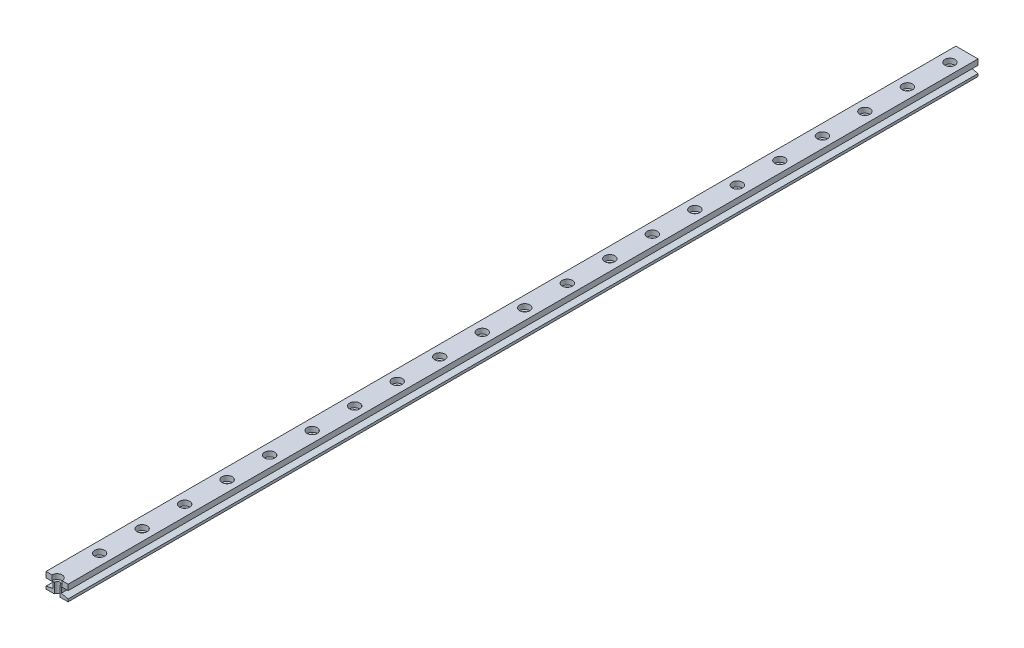
from build123d import *

# Parameters (mm, degrees)
EXTRUDE_1_DEPTH        = 800
SKETCH_2_R             = 3
CUT_EXTRUDE_1_DEPTH    = 3
CUT_EXTRUDE_2_REACH    = 802.049
SKETCH_3_R             = 1.6
PATTERN_LINEAR_1_COUNT = 32
PATTERN_LINEAR_1_PITCH = 25
SKETCH_5_W             = 302.225759888
SKETCH_5_H             = 503.019586662
CUT_EXTRUDE_3_DEPTH    = 10
SKETCH_6_W             = 27.58058317
SKETCH_6_H             = 207.193316332
CUT_EXTRUDE_4_DEPTH    = 10


with BuildPart() as part:
    # 草图1 → 凸台-拉伸1 (new body)
    with BuildSketch(Plane.XY):
        Polygon((-6.5, 4.5), (6.5, 4.5), (6.5, 1.2), (2.5, 1.2), (2.5, -2.076527235), (6.5, -3), (6.5, -4.5), (-6.5, -4.5), (-6.5, -3), (-2.5, -2.076527235), (-2.5, 1.2), (-6.5, 1.2), align=None)
    extrude(amount=EXTRUDE_1_DEPTH)

    # 草图2 → 切除-拉伸1 (cut)
    with BuildSketch(Plane(origin=(0, 4.5, 0), x_dir=(1, 0, 0), z_dir=(0, 1, 0))):
        with Locations(Location((0, -790, 0), (0, 0, 270))):
            Circle(SKETCH_2_R)
    cut_extrude_1 = extrude(amount=-CUT_EXTRUDE_1_DEPTH, mode=Mode.SUBTRACT)

    # 草图3 → 切除-拉伸2 (cut, up to next)
    with BuildSketch(Plane(origin=(0, 1.5, 0), x_dir=(1, 0, 0), z_dir=(0, 1, 0)), mode=Mode.PRIVATE) as cut_extrude_2_sk1:
        with Locations(Location((0, -790, 0), (0, 0, 270))):
            Circle(SKETCH_3_R)
    cut_extrude_2_tool1 = extrude(cut_extrude_2_sk1.sketch, amount=-CUT_EXTRUDE_2_REACH, mode=Mode.PRIVATE) & part.part
    cut_extrude_2 = cut_extrude_2_tool1.solids().sort_by_distance((0, 1.5, 790))[0]
    add(cut_extrude_2, mode=Mode.SUBTRACT)

    # 阵列(线性)1: 切除-拉伸1, 切除-拉伸2 ×32
    with Locations(*[(0, 0, -i * PATTERN_LINEAR_1_PITCH) for i in range(1, PATTERN_LINEAR_1_COUNT)]):
        add(cut_extrude_1, mode=Mode.SUBTRACT)
        add(cut_extrude_2, mode=Mode.SUBTRACT)

    # 草图5 → 切除-拉伸3 (cut)
    with BuildSketch(Plane(origin=(0, 4.5, 0), x_dir=(1, 0, 0), z_dir=(0, 1, 0))):
        with Locations((0, -941.509793331)):
            Rectangle(SKETCH_5_W, SKETCH_5_H)
    extrude(amount=-CUT_EXTRUDE_3_DEPTH, mode=Mode.SUBTRACT)

    # 草图6 → 切除-拉伸4 (cut)
    with BuildSketch(Plane(origin=(0, 4.5, 0), x_dir=(1, 0, 0), z_dir=(0, 1, 0))):
        with Locations((0, -51.403341834)):
            Rectangle(SKETCH_6_W, SKETCH_6_H)
    extrude(amount=-CUT_EXTRUDE_4_DEPTH, mode=Mode.SUBTRACT)


solid = part.part
